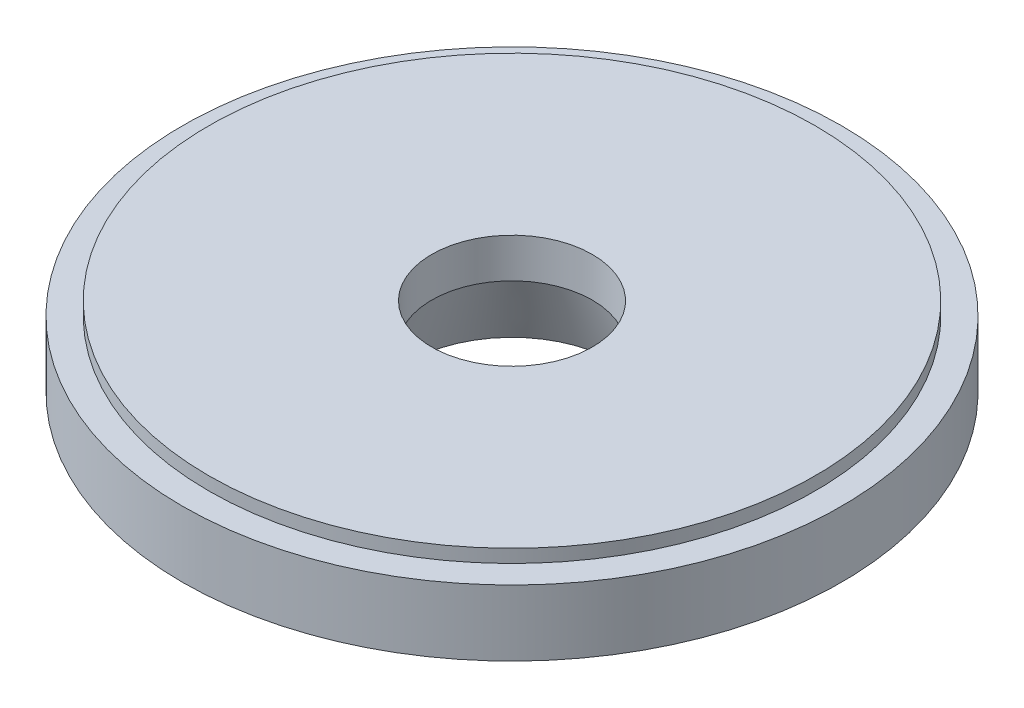
from build123d import *

# Parameters (mm, degrees)
SKETCH1_R           = 12.5
BOSS_EXTRUDE1_DEPTH = 2.5
SHELL1_T            = -1
SKETCH2_R           = 11.5
BOSS_EXTRUDE2_DEPTH = 0.5
SKETCH5_R           = 3.045955351
CUT_EXTRUDE3_DEPTH  = 10.5


with BuildPart() as part:
    # Sketch1 → Boss-Extrude1 (new body)
    with BuildSketch(Plane(origin=(0, 0, 0), x_dir=(1, 0, 0), z_dir=(0, 1, 0))):
        with Locations(Location((0, 0, 0), (0, 0, 270))):
            Circle(SKETCH1_R)
    extrude(amount=BOSS_EXTRUDE1_DEPTH)

    # Shell1
    shell1_openings = [part.faces().sort_by_distance(p)[0] for p in [
        (0, 0, 0),
    ]]
    offset(amount=SHELL1_T, openings=shell1_openings, kind=Kind.INTERSECTION)

    # Sketch2 → Boss-Extrude2 (add)
    with BuildSketch(Plane(origin=(0, 2.5, 0), x_dir=(1, 0, 0), z_dir=(0, 1, 0))):
        with Locations(Location((0, 0, 0), (0, 0, 270))):
            Circle(SKETCH2_R)
    extrude(amount=BOSS_EXTRUDE2_DEPTH)

    # Sketch4 → Revolve1 (revolve)
    with BuildSketch(Plane.XY, mode=Mode.PRIVATE) as revolve1_sk:
        Polygon((4.455880937, -1), (3.955880937, -1), (2.5, 3), (3, 3), align=None)
    revolve(revolve1_sk.sketch.rotate(Axis((0, 3, 0), (0, -1, 0)), 90), axis=Axis((0, 3, 0), (0, -1, 0)))

    # Sketch5 → Cut-Extrude3 (cut)
    with BuildSketch(Plane.XZ.offset(-1.5)):
        with Locations(Location((0, 0, 0), (0, 0, 270))):
            Circle(SKETCH5_R)
    extrude(amount=-CUT_EXTRUDE3_DEPTH, mode=Mode.SUBTRACT)


solid = part.part
